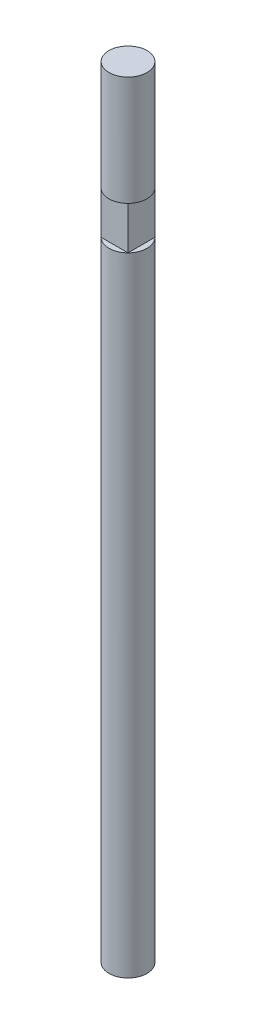
from build123d import *

# Parameters (mm, degrees)
CROQUIS1_R              = 2
SALIENTE_EXTRUIR1_DEPTH = 82
CORTAR_EXTRUIR1_DEPTH   = 4.5


with BuildPart() as part:
    # Croquis1 → Saliente-Extruir1 (new body)
    with BuildSketch(Plane(origin=(0, 0, 0), x_dir=(1, 0, 0), z_dir=(0, 1, 0))):
        with Locations(Location((0, 0, 0), (0, 0, 270))):
            Circle(CROQUIS1_R)
    extrude(amount=SALIENTE_EXTRUIR1_DEPTH)

    # Croquis2 → Cortar-Extruir1 (cut)
    with BuildSketch(Plane(origin=(0, 70.5, 0), x_dir=(1, 0, 0), z_dir=(0, 1, 0))):
        Polygon((2, -2), (-1.414213562, -2), (-1.414213562, -1.414213562), (1.414213562, -1.414213562), (1.414213562, 1.414213562), (2, 1.414213562), align=None)
    extrude(amount=-CORTAR_EXTRUIR1_DEPTH, mode=Mode.SUBTRACT)


solid = part.part
